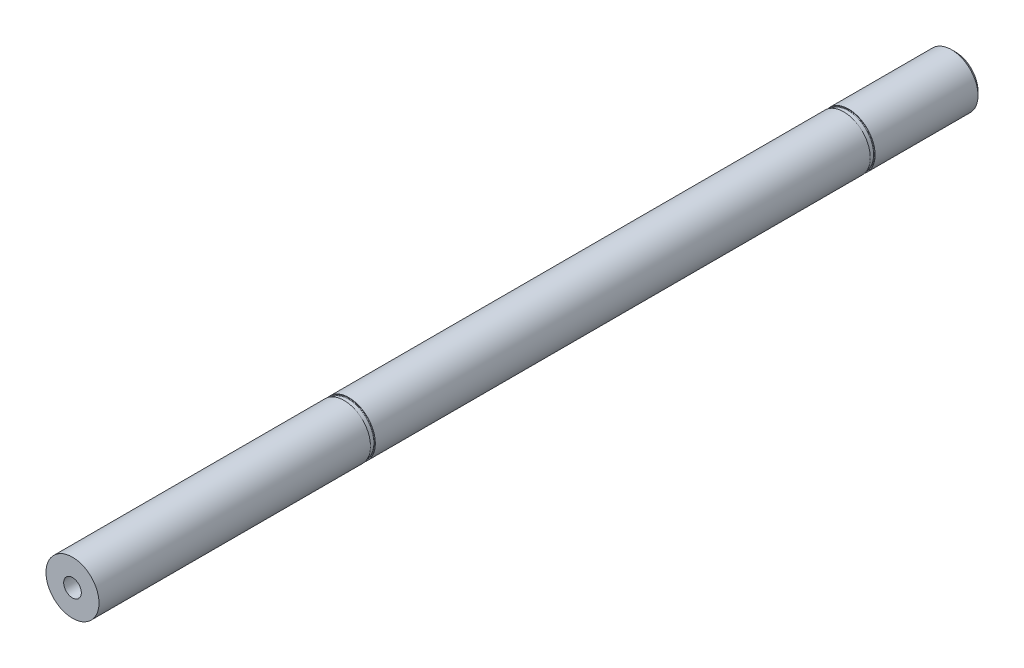
from build123d import *

# Parameters (mm, degrees)
SKETCH1_R           = 6
EXTRUDE1_DEPTH      = 100
CHAMFER1_SIZE       = 0.9
EXTRUDE3_DEPTH      = 101.359354322
EXTRUDE3_DEPTH_BACK = 101.359354322
SKETCH2_R           = 2


with BuildPart() as part:
    # Sketch1 → Extrude1 (new, symmetric)
    with BuildSketch(Plane.XY):
        Circle(SKETCH1_R)
    extrude(amount=EXTRUDE1_DEPTH, both=True)

    # Chamfer1
    chamfer1_edges = [part.edges().sort_by_distance(p)[0] for p in [
        (-6, 0, -100),
    ]]
    chamfer(chamfer1_edges, length=CHAMFER1_SIZE)

    # Sketch2 → Extrude3 (cut, two sides: drawn at the far end of the back side and taken through both)
    with BuildSketch(Plane.XY.offset(-EXTRUDE3_DEPTH_BACK)):
        Circle(SKETCH2_R)
    extrude(amount=EXTRUDE3_DEPTH + EXTRUDE3_DEPTH_BACK, mode=Mode.SUBTRACT)

    # Sketch5 → Groove for DIN 471 - 12 x 1_ Circlip for (revolve, cut)
    with BuildSketch(Plane(origin=(0, 0, 100), x_dir=(0, 1, 0), z_dir=(-1, 0, 0)), mode=Mode.PRIVATE) as groove_for_din_471_12_x_1_circlip_for_sk:
        with BuildLine():
            Line((5.86, 61.5), (7.2, 61.5))
            Line((7.2, 61.5), (7.2, 62.6))
            Line((7.2, 62.6), (5.86, 62.6))
            ThreePointArc((5.86, 62.6), (5.782218254, 62.567781746), (5.75, 62.49))
            Line((5.75, 62.49), (5.75, 61.61))
            ThreePointArc((5.75, 61.61), (5.782218254, 61.532218254), (5.86, 61.5))
        make_face()
    revolve(groove_for_din_471_12_x_1_circlip_for_sk.sketch.rotate(Axis((0, 0, 150), (0, 0, -1)), 270), axis=Axis((0, 0, 150), (0, 0, -1)), mode=Mode.SUBTRACT)

    # Sketch13 → Groove for DIN 471 - 12 x 1_ Circlip 2 (revolve, cut)
    with BuildSketch(Plane(origin=(0, 0, 100), x_dir=(0, 1, 0), z_dir=(-1, 0, 0)), mode=Mode.PRIVATE) as groove_for_din_471_12_x_1_circlip_2_sk:
        with BuildLine():
            Line((5.86, 174.7), (7.2, 174.7))
            Line((7.2, 174.7), (7.2, 175.8))
            Line((7.2, 175.8), (5.86, 175.8))
            ThreePointArc((5.86, 175.8), (5.782218254, 175.767781746), (5.75, 175.69))
            Line((5.75, 175.69), (5.75, 174.81))
            ThreePointArc((5.75, 174.81), (5.782218254, 174.732218254), (5.86, 174.7))
        make_face()
    revolve(groove_for_din_471_12_x_1_circlip_2_sk.sketch.rotate(Axis((0, 0, 150), (0, 0, -1)), 270), axis=Axis((0, 0, 150), (0, 0, -1)), mode=Mode.SUBTRACT)


solid = part.part
